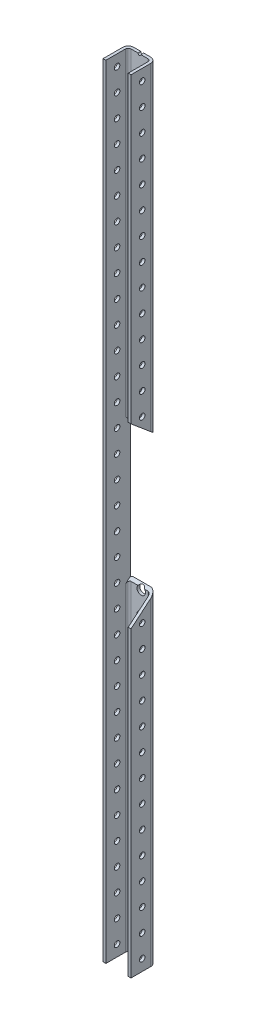
from build123d import *

# Parameters (mm, degrees)
BOSS_EXTRUDE1_DEPTH = 444.5
SKETCH3_R           = 1.651
SKETCH3_R_2         = 4.826
SKETCH3_R_3         = 1.5875
SKETCH3_R_4         = 3.175
CUT_EXTRUDE1_DEPTH  = 446.700343561
SKETCH4_R           = 3.175
CUT_EXTRUDE2_DEPTH  = 447.547694121
LPATTERN1_COUNT     = 35
LPATTERN1_PITCH     = 25.4
CUT_EXTRUDE3_START  = -12.7
CUT_EXTRUDE3_DEPTH  = 459.400343561


with BuildPart() as part:
    # Sketch2 → Boss-Extrude1 (new, symmetric)
    with BuildSketch(Plane(origin=(0, 0, 0), x_dir=(1, 0, 0), z_dir=(0, 1, 0))):
        with BuildLine():
            Line((-12.7, 0), (-12.7, 22.225))
            ThreePointArc((-12.7, 22.225), (-11.77006403, 24.47006403), (-9.525, 25.4))
            Line((-9.525, 25.4), (9.525, 25.4))
            ThreePointArc((9.525, 25.4), (11.77006403, 24.47006403), (12.7, 22.225))
            Line((12.7, 22.225), (12.7, 0))
            Line((12.7, 0), (15.875, 0))
            Line((15.875, 0), (15.875, 22.225))
            ThreePointArc((15.875, 22.225), (14.015128061, 26.715128061), (9.525, 28.575))
            Line((9.525, 28.575), (-9.525, 28.575))
            ThreePointArc((-9.525, 28.575), (-14.015128061, 26.715128061), (-15.875, 22.225))
            Line((-15.875, 22.225), (-15.875, 0))
            Line((-15.875, 0), (-12.7, 0))
        make_face()
    extrude(amount=BOSS_EXTRUDE1_DEPTH, both=True)

    # Sketch3 → Cut-Extrude1 (cut, through all)
    with BuildSketch(Plane(origin=(0, 0, -28.575), x_dir=(-1, 0, 0), z_dir=(0, 0, -1))):
        with Locations((0, 444.5)):
            Circle(SKETCH3_R)
        with Locations((-2.032, 361.95)):
            Circle(SKETCH3_R_2)
        with Locations((-2.032, 336.55)):
            Circle(SKETCH3_R_2)
        with Locations((-2.032, 107.95)):
            Circle(SKETCH3_R_2)
        with Locations((-2.032, 82.55)):
            Circle(SKETCH3_R_2)
        with Locations((-2.032, -107.95)):
            Circle(SKETCH3_R_2)
        with Locations((-2.032, -82.55)):
            Circle(SKETCH3_R_2)
        with Locations((0, -241.3)):
            Circle(SKETCH3_R_3)
        with Locations((0, 118.11)):
            Circle(SKETCH3_R_4)
        with Locations((-2.032, -336.55)):
            Circle(SKETCH3_R_2)
        with Locations((-2.032, -361.95)):
            Circle(SKETCH3_R_2)
        with Locations((0, 159.512)):
            Circle(SKETCH3_R_4)
        with Locations((0, -159.512)):
            Circle(SKETCH3_R_4)
        with Locations((0, -118.11)):
            Circle(SKETCH3_R_4)
    extrude(amount=-CUT_EXTRUDE1_DEPTH, mode=Mode.SUBTRACT)

    # Sketch4 → Cut-Extrude2 (cut, through all)
    with BuildSketch(Plane(origin=(15.875, 0, 0), x_dir=(0, 0, -1), z_dir=(1, 0, 0))):
        with Locations((12.7, 431.8)):
            Circle(SKETCH4_R)
    cut_extrude2 = extrude(amount=-CUT_EXTRUDE2_DEPTH, mode=Mode.SUBTRACT)

    # LPattern1: Cut-Extrude2 ×35
    with Locations(*[(0, -i * LPATTERN1_PITCH, 0) for i in range(1, LPATTERN1_COUNT)]):
        add(cut_extrude2, mode=Mode.SUBTRACT)

    # Sketch5 → Cut-Extrude3 (cut, through all)
    with BuildSketch(Plane(origin=(0, 0, 0), x_dir=(0, 0, -1), z_dir=(1, 0, 0)).offset(CUT_EXTRUDE3_START)):
        Polygon((0, 100.838), (0, -100.838), (28.575, -76.835), (28.575, 76.835), align=None)
    extrude(amount=CUT_EXTRUDE3_DEPTH, mode=Mode.SUBTRACT)


solid = part.part
